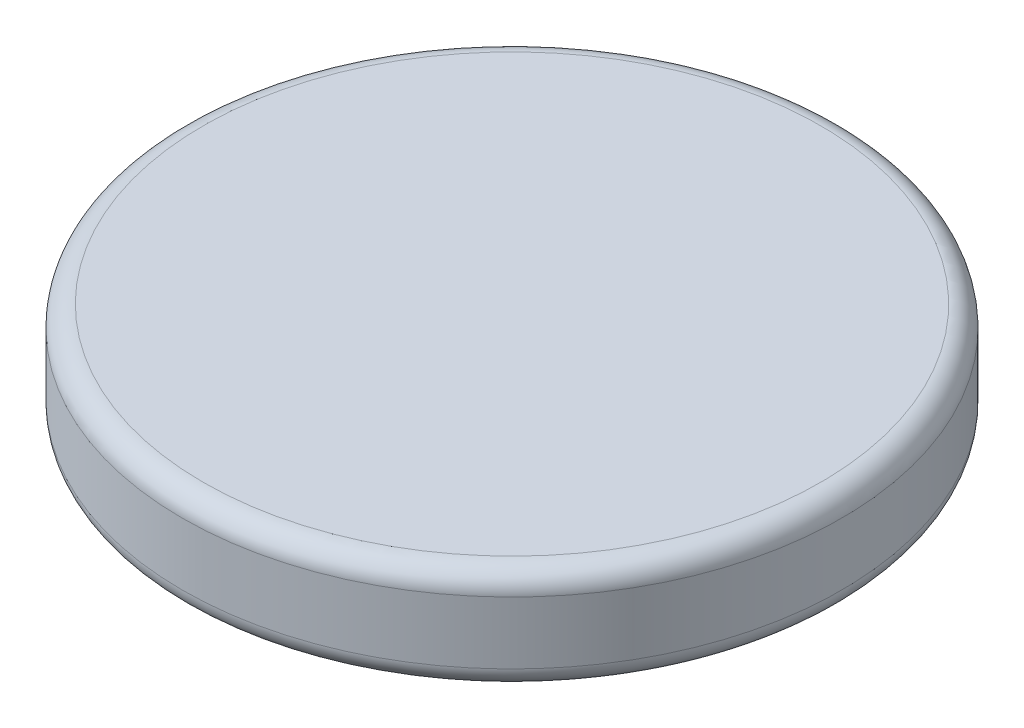
from build123d import *

# Parameters (mm, degrees)
SKETCH3_R           = 317.5
BOSS_EXTRUDE2_DEPTH = 100
FILLET5_R           = 20
SKETCH4_R           = 63.5
SKETCH4_R_2         = 50.8
BOSS_EXTRUDE3_DEPTH = 10


with BuildPart() as part:
    # Sketch3 → Boss-Extrude2 (new body)
    with BuildSketch(Plane(origin=(0, 0, 0), x_dir=(1, 0, 0), z_dir=(0, 1, 0))):
        with Locations(Location((0, 0, 0), (0, 0, 270))):
            Circle(SKETCH3_R)
    extrude(amount=BOSS_EXTRUDE2_DEPTH)

    # Fillet5
    fillet5_edges = [part.edges().sort_by_distance(p)[0] for p in [
        (0, 0, -317.5),
        (0, 100, -317.5),
    ]]
    fillet(fillet5_edges, radius=FILLET5_R)

    # Sketch4 → Boss-Extrude3 (add)
    with BuildSketch(Plane(origin=(0, 0, 0), x_dir=(1, 0, 0), z_dir=(0, 1, 0))):
        with Locations(Location((0, 0, 0), (0, 0, 270))):
            Circle(SKETCH4_R)
        with Locations(Location((0, 0, 0), (0, 0, 270))):
            Circle(SKETCH4_R_2, mode=Mode.SUBTRACT)
    extrude(amount=-BOSS_EXTRUDE3_DEPTH)


solid = part.part
